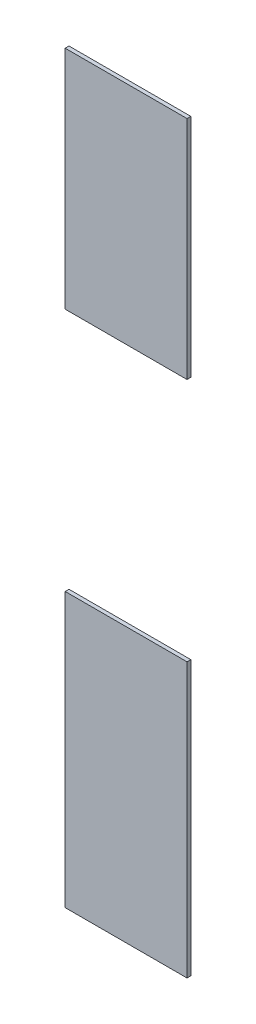
from build123d import *

# Parameters (mm, degrees)
SKETCH_1_W        = 400
SKETCH_1_H        = 742.25
EXTRUDE_1_DEPTH   = 12.5
SKETCH_1_H_2      = 899.25
EXTRUDE_1_2_DEPTH = 12.5


with BuildPart() as part:
    # Эскиз1 → Бобышка-Вытянуть1 (new body)
    with BuildSketch(Plane.XY):
        with Locations((200, -371.125)):
            Rectangle(SKETCH_1_W, SKETCH_1_H)
    extrude(amount=EXTRUDE_1_DEPTH)


with BuildPart() as body_2:
    # Эскиз1 → Extrude 1 2 (new body)
    with BuildSketch(Plane.XY):
        with Locations((200, -1994.625)):
            Rectangle(SKETCH_1_W, SKETCH_1_H_2)
    extrude(amount=EXTRUDE_1_2_DEPTH)


solid = Compound([part.part, body_2.part])
